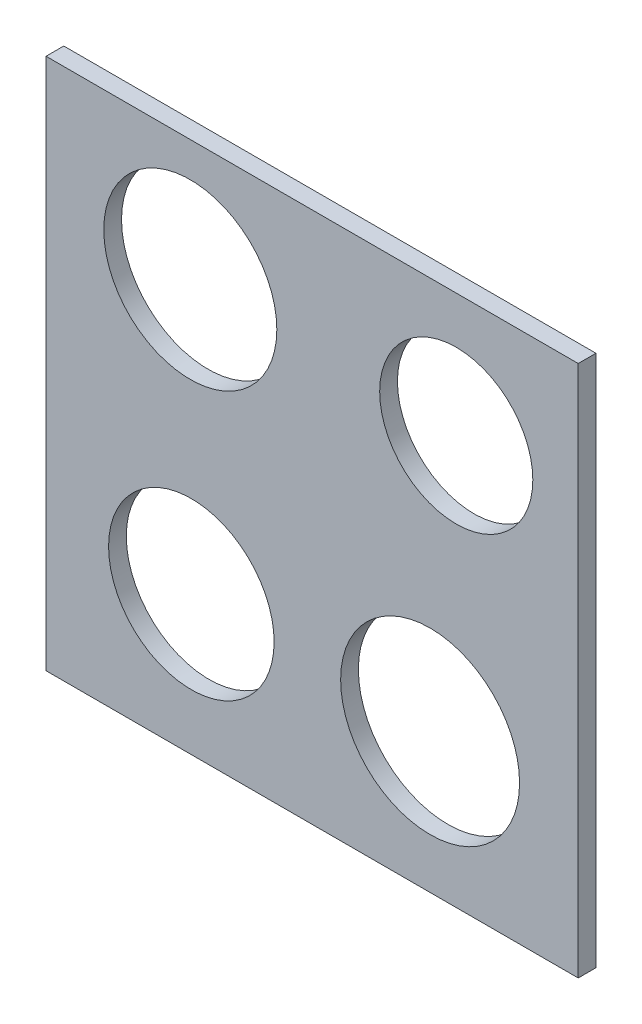
from build123d import *

# Parameters (mm, degrees)
SKETCH1_W           = 30
SKETCH1_H           = 30
BOSS_EXTRUDE1_DEPTH = 1
SKETCH2_R           = 4.316163829
CUT_EXTRUDE1_DEPTH  = 3
SKETCH3_R           = 5.043132961
CUT_EXTRUDE2_DEPTH  = 3
SKETCH4_R           = 4.877423457
CUT_EXTRUDE3_DEPTH  = 3
SKETCH5_R           = 4.666431363
CUT_EXTRUDE4_DEPTH  = 3


with BuildPart() as part:
    # Sketch1 → Boss-Extrude1 (new body)
    with BuildSketch(Plane.XY):
        Rectangle(SKETCH1_W, SKETCH1_H)
    extrude(amount=BOSS_EXTRUDE1_DEPTH)

    # Sketch2 → Cut-Extrude1 (cut)
    with BuildSketch(Plane(origin=(0, 0, 0), x_dir=(-1, 0, 0), z_dir=(0, 0, -1))):
        with Locations((-8.12429837, 8.038997658)):
            Circle(SKETCH2_R)
    extrude(amount=-CUT_EXTRUDE1_DEPTH, mode=Mode.SUBTRACT)

    # Sketch3 → Cut-Extrude2 (cut)
    with BuildSketch(Plane(origin=(0, 0, 0), x_dir=(-1, 0, 0), z_dir=(0, 0, -1))):
        with Locations((-6.650270789, -7.131419922)):
            Circle(SKETCH3_R)
    extrude(amount=-CUT_EXTRUDE2_DEPTH, mode=Mode.SUBTRACT)

    # Sketch4 → Cut-Extrude3 (cut)
    with BuildSketch(Plane(origin=(0, 0, 0), x_dir=(-1, 0, 0), z_dir=(0, 0, -1))):
        with Locations((6.8674749, 8.16200162)):
            Circle(SKETCH4_R)
    extrude(amount=-CUT_EXTRUDE3_DEPTH, mode=Mode.SUBTRACT)

    # Sketch5 → Cut-Extrude4 (cut)
    with BuildSketch(Plane(origin=(0, 0, 0), x_dir=(-1, 0, 0), z_dir=(0, 0, -1))):
        with Locations((6.808728507, -7.165302377)):
            Circle(SKETCH5_R)
    extrude(amount=-CUT_EXTRUDE4_DEPTH, mode=Mode.SUBTRACT)


solid = part.part
